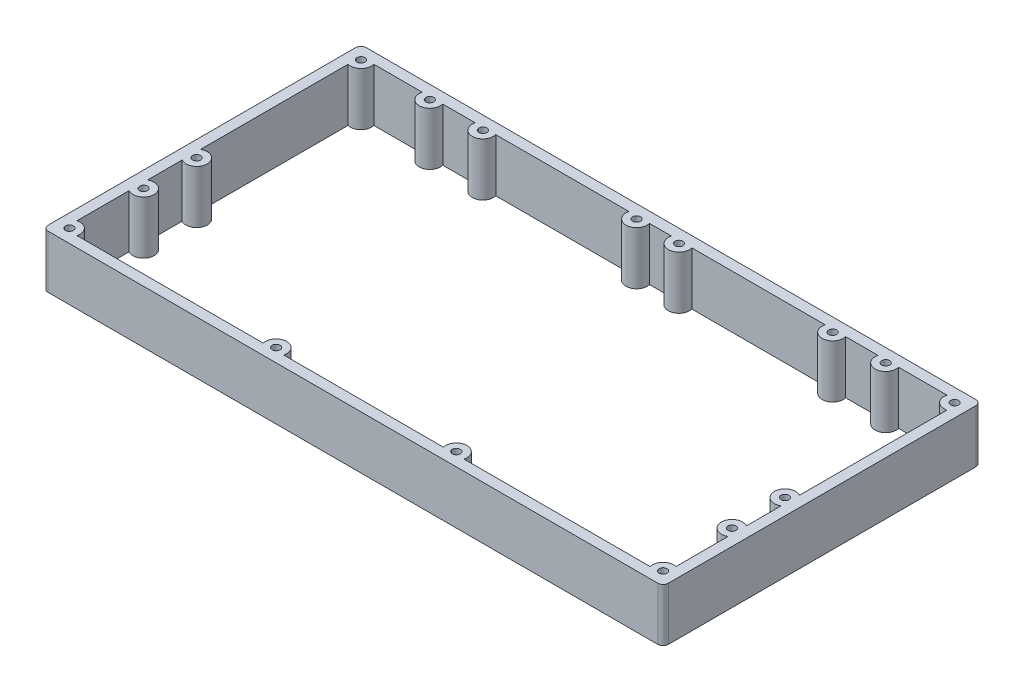
from build123d import *

# Parameters (mm, degrees)
SKETCH_1_W          = 234
SKETCH_1_H          = 120
SKETCH_1_R          = 45
EXTRUDE_1_DEPTH     = 3
SKETCH_2_R          = 1.5
CUT_EXTRUDE_1_DEPTH = 3
SKETCH_3_R          = 1.5
CUT_EXTRUDE_2_DEPTH = 3
SKETCH_4_R          = 1.5
CUT_EXTRUDE_3_DEPTH = 3
SKETCH_5_R          = 1.5
CUT_EXTRUDE_4_DEPTH = 3
FILLET_1_R          = 2
CUT_EXTRUDE_5_DEPTH = 10
EXTRUDE_START       = 17
SKETCH_7_R          = 1.5
EXTRUDE_2_DEPTH     = 17
CUT_EXTRUDE_6_DEPTH = 50
CUT_EXTRUDE_7_DEPTH = 73


with BuildPart() as part:
    # 草图1 → 凸台-拉伸1 (new body)
    with BuildSketch(Plane(origin=(0, 0, 0), x_dir=(1, 0, 0), z_dir=(0, 1, 0))):
        Rectangle(SKETCH_1_W, SKETCH_1_H)
        with Locations(Location((-58.5, 0, 0), (0, 0, 270))):
            Circle(SKETCH_1_R, mode=Mode.SUBTRACT)
        with Locations(Location((58.5, 0, 0), (0, 0, 90))):
            Circle(SKETCH_1_R, mode=Mode.SUBTRACT)
    extrude(amount=EXTRUDE_1_DEPTH)

    # 草图2 → 切除-拉伸1 (cut)
    with BuildSketch(Plane(origin=(0, 3, 0), x_dir=(1, 0, 0), z_dir=(0, 1, 0))):
        with Locations(Location((-88.5, -40, 0), (0, 0, 270))):
            Circle(SKETCH_2_R)
        with Locations(Location((-83.5, 43.301270189, 0), (0, 0, 270))):
            Circle(SKETCH_2_R)
        with Locations(Location((-33.5, 43.301270189, 0), (0, 0, 90))):
            Circle(SKETCH_2_R)
        with Locations(Location((-28.5, -40, 0), (0, 0, 90))):
            Circle(SKETCH_2_R)
        with Locations(Location((28.5, -40, 0), (0, 0, 270))):
            Circle(SKETCH_2_R)
        with Locations(Location((88.5, -40, 0), (0, 0, 90))):
            Circle(SKETCH_2_R)
        with Locations(Location((33.5, 43.301270189, 0), (0, 0, 270))):
            Circle(SKETCH_2_R)
        with Locations(Location((83.5, 43.301270189, 0), (0, 0, 90))):
            Circle(SKETCH_2_R)
    extrude(amount=-CUT_EXTRUDE_1_DEPTH, mode=Mode.SUBTRACT)

    # 草图3 → 切除-拉伸2 (cut)
    with BuildSketch(Plane(origin=(0, 3, 0), x_dir=(1, 0, 0), z_dir=(0, 1, 0))):
        with Locations(Location((-111, -28, 0), (0, 0, 270))):
            Circle(SKETCH_3_R)
        with Locations(Location((-111, -8, 0), (0, 0, 270))):
            Circle(SKETCH_3_R)
        with Locations(Location((111, -8, 0), (0, 0, 90))):
            Circle(SKETCH_3_R)
        with Locations(Location((111, -28, 0), (0, 0, 90))):
            Circle(SKETCH_3_R)
        with Locations(Location((-86, 55, 0), (0, 0, 270))):
            Circle(SKETCH_3_R)
        with Locations(Location((-66, 55, 0), (0, 0, 270))):
            Circle(SKETCH_3_R)
        with Locations(Location((66, 55, 0), (0, 0, 90))):
            Circle(SKETCH_3_R)
        with Locations(Location((86, 55, 0), (0, 0, 90))):
            Circle(SKETCH_3_R)
    extrude(amount=-CUT_EXTRUDE_2_DEPTH, mode=Mode.SUBTRACT)

    # 草图4 → 切除-拉伸3 (cut)
    with BuildSketch(Plane(origin=(0, 3, 0), x_dir=(1, 0, 0), z_dir=(0, 1, 0))):
        with Locations(Location((-112, -55, 0), (0, 0, 270))):
            Circle(SKETCH_4_R)
        with Locations(Location((-112, 55, 0), (0, 0, 270))):
            Circle(SKETCH_4_R)
        with Locations(Location((112, 55, 0), (0, 0, 270))):
            Circle(SKETCH_4_R)
        with Locations(Location((112, -55, 0), (0, 0, 270))):
            Circle(SKETCH_4_R)
        with Locations(Location((-34, -55, 0), (0, 0, 270))):
            Circle(SKETCH_4_R)
        with Locations(Location((34, -55, 0), (0, 0, 270))):
            Circle(SKETCH_4_R)
    extrude(amount=-CUT_EXTRUDE_3_DEPTH, mode=Mode.SUBTRACT)

    # 草图5 → 切除-拉伸4 (cut)
    with BuildSketch(Plane(origin=(0, 3, 0), x_dir=(1, 0, 0), z_dir=(0, 1, 0))):
        with Locations(Location((-8, 55, 0), (0, 0, 270))):
            Circle(SKETCH_5_R)
        with Locations(Location((8, 55, 0), (0, 0, 270))):
            Circle(SKETCH_5_R)
    extrude(amount=-CUT_EXTRUDE_4_DEPTH, mode=Mode.SUBTRACT)

    # 圆角1
    fillet_1_edges = [part.edges().sort_by_distance(p)[0] for p in [
        (117, 1.5, 60),
        (-117, 1.5, 60),
        (-117, 1.5, -60),
        (117, 1.5, -60),
    ]]
    fillet(fillet_1_edges, radius=FILLET_1_R)

    # 草图6 → 切除-拉伸5 (cut)
    with BuildSketch(Plane(origin=(0, 3, 0), x_dir=(1, 0, 0), z_dir=(0, 1, 0))):
        with BuildLine():
            Line((109.5, -12.769696007), (109.5, -23.230303993))
            ThreePointArc((109.5, -23.230303993), (106, -28), (109.5, -32.769696007))
            Line((109.5, -32.769696007), (109.5, -50.669872981))
            ThreePointArc((109.5, -50.669872981), (108.464466094, -51.464466094), (107.669872981, -52.5))
            Line((107.669872981, -52.5), (38.330127019, -52.5))
            ThreePointArc((38.330127019, -52.5), (34, -50), (29.669872981, -52.5))
            Line((29.669872981, -52.5), (-29.669872981, -52.5))
            ThreePointArc((-29.669872981, -52.5), (-34, -50), (-38.330127019, -52.5))
            Line((-38.330127019, -52.5), (-107.669872981, -52.5))
            ThreePointArc((-107.669872981, -52.5), (-108.464466094, -51.464466094), (-109.5, -50.669872981))
            Line((-109.5, -50.669872981), (-109.5, -32.769696007))
            ThreePointArc((-109.5, -32.769696007), (-106, -28), (-109.5, -23.230303993))
            Line((-109.5, -23.230303993), (-109.5, -12.769696007))
            ThreePointArc((-109.5, -12.769696007), (-106, -8), (-109.5, -3.230303993))
            Line((-109.5, -3.230303993), (-109.5, 50.669872981))
            ThreePointArc((-109.5, 50.669872981), (-108.464466094, 51.464466094), (-107.669872981, 52.5))
            Line((-107.669872981, 52.5), (-90.330127019, 52.5))
            ThreePointArc((-90.330127019, 52.5), (-86, 50), (-81.669872981, 52.5))
            Line((-81.669872981, 52.5), (-70.330127019, 52.5))
            ThreePointArc((-70.330127019, 52.5), (-66, 50), (-61.669872981, 52.5))
            Line((-61.669872981, 52.5), (-12.330127019, 52.5))
            ThreePointArc((-12.330127019, 52.5), (-8, 50), (-3.669872981, 52.5))
            Line((-3.669872981, 52.5), (3.669872981, 52.5))
            ThreePointArc((3.669872981, 52.5), (8, 50), (12.330127019, 52.5))
            Line((12.330127019, 52.5), (61.669872981, 52.5))
            ThreePointArc((61.669872981, 52.5), (66, 50), (70.330127019, 52.5))
            Line((70.330127019, 52.5), (81.669872981, 52.5))
            ThreePointArc((81.669872981, 52.5), (86, 50), (90.330127019, 52.5))
            Line((90.330127019, 52.5), (107.669872981, 52.5))
            ThreePointArc((107.669872981, 52.5), (108.464466094, 51.464466094), (109.5, 50.669872981))
            Line((109.5, 50.669872981), (109.5, -3.230303993))
            ThreePointArc((109.5, -3.230303993), (106, -8), (109.5, -12.769696007))
        make_face()
    extrude(amount=-CUT_EXTRUDE_5_DEPTH, mode=Mode.SUBTRACT)

    # 草图7 → 凸台-拉伸2 (add)
    with BuildSketch(Plane(origin=(0, 3, 0), x_dir=(1, 0, 0), z_dir=(0, 1, 0)).offset(EXTRUDE_START)):
        with BuildLine():
            Line((-117, 58), (-117, -58))
            ThreePointArc((-117, -58), (-116.414213562, -59.414213562), (-115, -60))
            Line((-115, -60), (115, -60))
            ThreePointArc((115, -60), (116.414213562, -59.414213562), (117, -58))
            Line((117, -58), (117, 58))
            ThreePointArc((117, 58), (116.414213562, 59.414213562), (115, 60))
            Line((115, 60), (-115, 60))
            ThreePointArc((-115, 60), (-116.414213562, 59.414213562), (-117, 58))
        make_face()
        with Locations(Location((112, -55, 0), (0, 0, 270))):
            Circle(SKETCH_7_R, mode=Mode.SUBTRACT)
        with Locations(Location((111, -28, 0), (0, 0, 270))):
            Circle(SKETCH_7_R, mode=Mode.SUBTRACT)
        with Locations(Location((111, -8, 0), (0, 0, 270))):
            Circle(SKETCH_7_R, mode=Mode.SUBTRACT)
        with Locations(Location((112, 55, 0), (0, 0, 270))):
            Circle(SKETCH_7_R, mode=Mode.SUBTRACT)
        with Locations(Location((34, -55, 0), (0, 0, 270))):
            Circle(SKETCH_7_R, mode=Mode.SUBTRACT)
        with Locations(Location((-34, -55, 0), (0, 0, 270))):
            Circle(SKETCH_7_R, mode=Mode.SUBTRACT)
        with Locations(Location((86, 55, 0), (0, 0, 270))):
            Circle(SKETCH_7_R, mode=Mode.SUBTRACT)
        with Locations(Location((66, 55, 0), (0, 0, 270))):
            Circle(SKETCH_7_R, mode=Mode.SUBTRACT)
        with Locations(Location((8, 55, 0), (0, 0, 270))):
            Circle(SKETCH_7_R, mode=Mode.SUBTRACT)
        with Locations(Location((-8, 55, 0), (0, 0, 270))):
            Circle(SKETCH_7_R, mode=Mode.SUBTRACT)
        with Locations(Location((-66, 55, 0), (0, 0, 270))):
            Circle(SKETCH_7_R, mode=Mode.SUBTRACT)
        with Locations(Location((-86, 55, 0), (0, 0, 270))):
            Circle(SKETCH_7_R, mode=Mode.SUBTRACT)
        with Locations(Location((-112, 55, 0), (0, 0, 270))):
            Circle(SKETCH_7_R, mode=Mode.SUBTRACT)
        with Locations(Location((-112, -55, 0), (0, 0, 270))):
            Circle(SKETCH_7_R, mode=Mode.SUBTRACT)
        with Locations(Location((-111, -28, 0), (0, 0, 270))):
            Circle(SKETCH_7_R, mode=Mode.SUBTRACT)
        with Locations(Location((-111, -8, 0), (0, 0, 270))):
            Circle(SKETCH_7_R, mode=Mode.SUBTRACT)
        with BuildLine():
            Line((109.5, -50.669872981), (109.5, -32.769696007))
            ThreePointArc((109.5, -32.769696007), (106, -28), (109.5, -23.230303993))
            Line((109.5, -23.230303993), (109.5, -12.769696007))
            ThreePointArc((109.5, -12.769696007), (106, -8), (109.5, -3.230303993))
            Line((109.5, -3.230303993), (109.5, 50.669872981))
            ThreePointArc((109.5, 50.669872981), (108.464466094, 51.464466094), (107.669872981, 52.5))
            Line((107.669872981, 52.5), (90.330127019, 52.5))
            ThreePointArc((90.330127019, 52.5), (86, 50), (81.669872981, 52.5))
            Line((81.669872981, 52.5), (70.330127019, 52.5))
            ThreePointArc((70.330127019, 52.5), (66, 50), (61.669872981, 52.5))
            Line((61.669872981, 52.5), (12.330127019, 52.5))
            ThreePointArc((12.330127019, 52.5), (8, 50), (3.669872981, 52.5))
            Line((3.669872981, 52.5), (-3.669872981, 52.5))
            ThreePointArc((-3.669872981, 52.5), (-8, 50), (-12.330127019, 52.5))
            Line((-12.330127019, 52.5), (-61.669872981, 52.5))
            ThreePointArc((-61.669872981, 52.5), (-66, 50), (-70.330127019, 52.5))
            Line((-70.330127019, 52.5), (-81.669872981, 52.5))
            ThreePointArc((-81.669872981, 52.5), (-86, 50), (-90.330127019, 52.5))
            Line((-90.330127019, 52.5), (-107.669872981, 52.5))
            ThreePointArc((-107.669872981, 52.5), (-108.464466094, 51.464466094), (-109.5, 50.669872981))
            Line((-109.5, 50.669872981), (-109.5, -3.230303993))
            ThreePointArc((-109.5, -3.230303993), (-106, -8), (-109.5, -12.769696007))
            Line((-109.5, -12.769696007), (-109.5, -23.230303993))
            ThreePointArc((-109.5, -23.230303993), (-106, -28), (-109.5, -32.769696007))
            Line((-109.5, -32.769696007), (-109.5, -50.669872981))
            ThreePointArc((-109.5, -50.669872981), (-108.464466094, -51.464466094), (-107.669872981, -52.5))
            Line((-107.669872981, -52.5), (-38.330127019, -52.5))
            ThreePointArc((-38.330127019, -52.5), (-34, -50), (-29.669872981, -52.5))
            Line((-29.669872981, -52.5), (29.669872981, -52.5))
            ThreePointArc((29.669872981, -52.5), (34, -50), (38.330127019, -52.5))
            Line((38.330127019, -52.5), (107.669872981, -52.5))
            ThreePointArc((107.669872981, -52.5), (108.464466094, -51.464466094), (109.5, -50.669872981))
        make_face(mode=Mode.SUBTRACT)
    extrude(amount=-EXTRUDE_2_DEPTH)

    # 草图8 → 切除-拉伸6 (cut)
    with BuildSketch(Plane(origin=(0, 20, 0), x_dir=(1, 0, 0), z_dir=(0, 1, 0))):
        with BuildLine():
            Line((-90, 55), (-108, 55))
            ThreePointArc((-108, 55), (-109.171572875, 52.171572875), (-112, 51))
            Line((-112, 51), (-112, -4.127016654))
            ThreePointArc((-112, -4.127016654), (-107, -8), (-112, -11.872983346))
            Line((-112, -11.872983346), (-112, -24.127016654))
            ThreePointArc((-112, -24.127016654), (-107, -28), (-112, -31.872983346))
            Line((-112, -31.872983346), (-112, -51))
            ThreePointArc((-112, -51), (-109.171572875, -52.171572875), (-108, -55))
            Line((-108, -55), (-38, -55))
            ThreePointArc((-38, -55), (-34, -51), (-30, -55))
            Line((-30, -55), (30, -55))
            ThreePointArc((30, -55), (34, -51), (38, -55))
            Line((38, -55), (108, -55))
            ThreePointArc((108, -55), (109.171572875, -52.171572875), (112, -51))
            Line((112, -51), (112, -31.872983346))
            ThreePointArc((112, -31.872983346), (107, -28), (112, -24.127016654))
            Line((112, -24.127016654), (112, -11.872983346))
            ThreePointArc((112, -11.872983346), (107, -8), (112, -4.127016654))
            Line((112, -4.127016654), (112, 51))
            ThreePointArc((112, 51), (109.171572875, 52.171572875), (108, 55))
            Line((108, 55), (90, 55))
            ThreePointArc((90, 55), (86, 51), (82, 55))
            Line((82, 55), (70, 55))
            ThreePointArc((70, 55), (66, 51), (62, 55))
            Line((62, 55), (12, 55))
            ThreePointArc((12, 55), (8, 51), (4, 55))
            Line((4, 55), (-4, 55))
            ThreePointArc((-4, 55), (-8, 51), (-12, 55))
            Line((-12, 55), (-62, 55))
            ThreePointArc((-62, 55), (-66, 51), (-70, 55))
            Line((-70, 55), (-82, 55))
            ThreePointArc((-82, 55), (-86, 51), (-90, 55))
        make_face()
    extrude(amount=-CUT_EXTRUDE_6_DEPTH, mode=Mode.SUBTRACT)

    # 草图9 → 切除-拉伸7 (cut)
    with BuildSketch(Plane(origin=(0, 20, 0), x_dir=(1, 0, 0), z_dir=(0, 1, 0))):
        with BuildLine():
            Line((113, 51.127016654), (113, -4.535898385))
            ThreePointArc((113, -4.535898385), (107, -8), (113, -11.464101615))
            Line((113, -11.464101615), (113, -24.535898385))
            ThreePointArc((113, -24.535898385), (107, -28), (113, -31.464101615))
            Line((113, -31.464101615), (113, -51.127016654))
            ThreePointArc((113, -51.127016654), (109.171572875, -52.171572875), (108.127016654, -56))
            Line((108.127016654, -56), (37.872983346, -56))
            ThreePointArc((37.872983346, -56), (34, -51), (30.127016654, -56))
            Line((30.127016654, -56), (-30.127016654, -56))
            ThreePointArc((-30.127016654, -56), (-34, -51), (-37.872983346, -56))
            Line((-37.872983346, -56), (-108.127016654, -56))
            ThreePointArc((-108.127016654, -56), (-109.171572875, -52.171572875), (-113, -51.127016654))
            Line((-113, -51.127016654), (-113, -31.464101615))
            ThreePointArc((-113, -31.464101615), (-107, -28), (-113, -24.535898385))
            Line((-113, -24.535898385), (-113, -11.464101615))
            ThreePointArc((-113, -11.464101615), (-107, -8), (-113, -4.535898385))
            Line((-113, -4.535898385), (-113, 51.127016654))
            ThreePointArc((-113, 51.127016654), (-109.171572875, 52.171572875), (-108.127016654, 56))
            Line((-108.127016654, 56), (-89.872983346, 56))
            ThreePointArc((-89.872983346, 56), (-86, 51), (-82.127016654, 56))
            Line((-82.127016654, 56), (-69.872983346, 56))
            ThreePointArc((-69.872983346, 56), (-66, 51), (-62.127016654, 56))
            Line((-62.127016654, 56), (-11.872983346, 56))
            ThreePointArc((-11.872983346, 56), (-8, 51), (-4.127016654, 56))
            Line((-4.127016654, 56), (4.127016654, 56))
            ThreePointArc((4.127016654, 56), (8, 51), (11.872983346, 56))
            Line((11.872983346, 56), (62.127016654, 56))
            ThreePointArc((62.127016654, 56), (66, 51), (69.872983346, 56))
            Line((69.872983346, 56), (82.127016654, 56))
            ThreePointArc((82.127016654, 56), (86, 51), (89.872983346, 56))
            Line((89.872983346, 56), (108.127016654, 56))
            ThreePointArc((108.127016654, 56), (109.171572875, 52.171572875), (113, 51.127016654))
        make_face()
    extrude(amount=-CUT_EXTRUDE_7_DEPTH, mode=Mode.SUBTRACT)


solid = part.part
